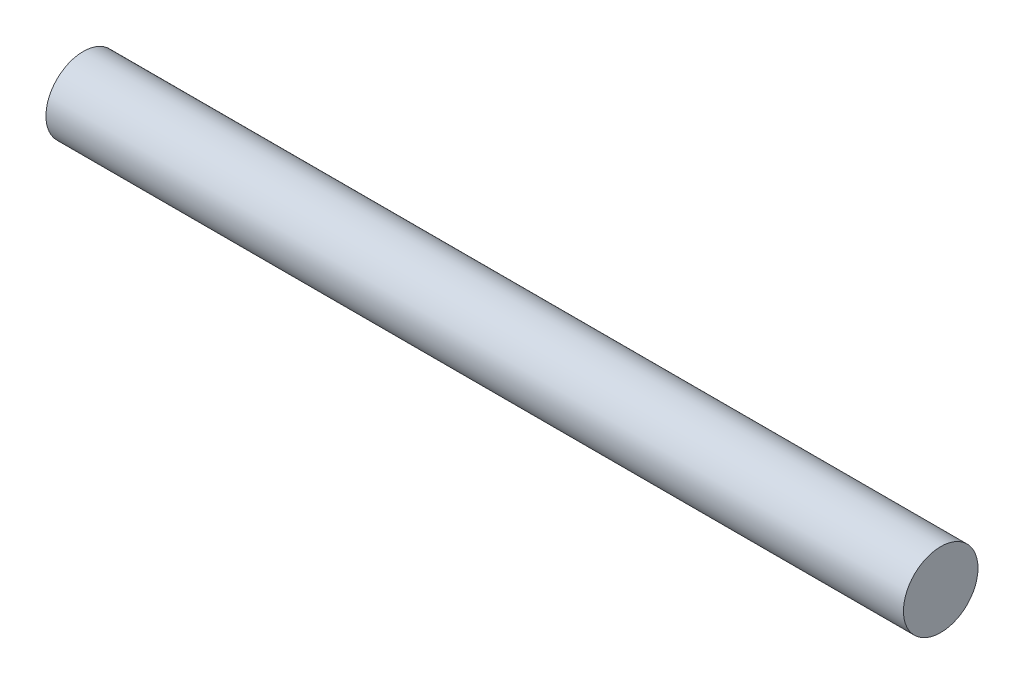
from build123d import *

# Parameters (mm, degrees)
SKETCH2_R           = 1.5
BOSS_EXTRUDE1_DEPTH = 34.5


with BuildPart() as part:
    # Sketch2 → Boss-Extrude1 (new body)
    with BuildSketch(Plane(origin=(0, 0, 0), x_dir=(0, 0, -1), z_dir=(1, 0, 0))):
        Circle(SKETCH2_R)
    extrude(amount=BOSS_EXTRUDE1_DEPTH)


solid = part.part
